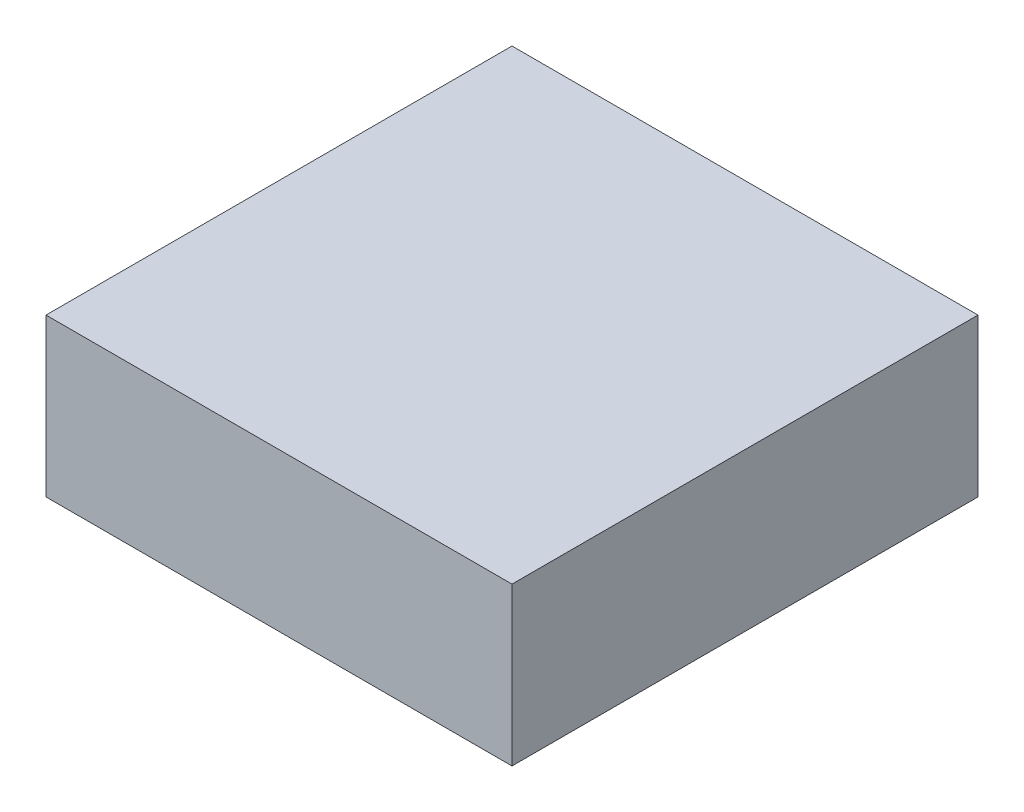
from build123d import *

# Parameters (mm, degrees)
SKETCH2_W           = 18.034
SKETCH2_H           = 18.034
BOSS_EXTRUDE1_DEPTH = 6.096


with BuildPart() as part:
    # Sketch2 → Boss-Extrude1 (new body)
    with BuildSketch(Plane(origin=(0, 0, 0), x_dir=(1, 0, 0), z_dir=(0, 1, 0))):
        Rectangle(SKETCH2_W, SKETCH2_H)
    extrude(amount=BOSS_EXTRUDE1_DEPTH)


solid = part.part
